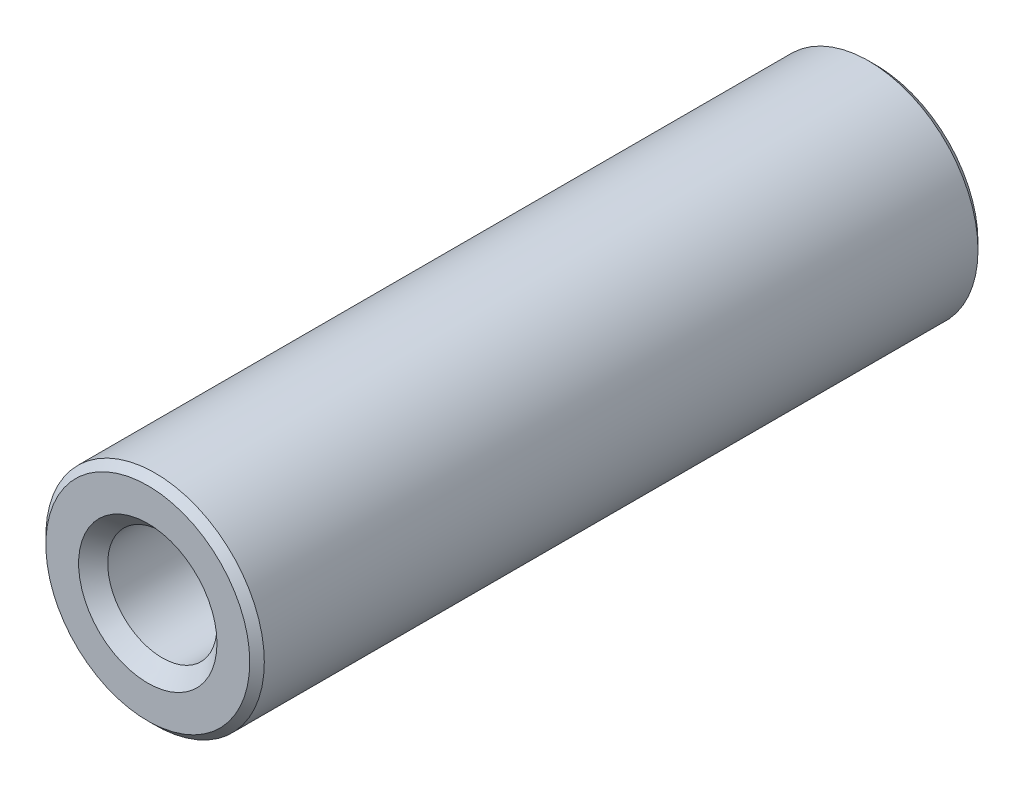
from build123d import *


with BuildPart() as part:
    # 草图1 → 旋转1 (revolve)
    with BuildSketch(Plane(origin=(0, 0, 0), x_dir=(1, 0, 0), z_dir=(0, 1, 0))):
        Polygon((1.5, -9.399940727), (0, -9.399940727), (0, -20.600059273), (1.5, -20.600059273), (1.5, -24.600059273), (1.899924924, -25), (2.79992954, -25), (3, -24.799924505), (3, -5.200041756), (2.799961089, -5), (1.899924924, -5), (1.5, -5.399940727), align=None)
    revolve(axis=Axis((0, 0, -25.003051641), (0, 0, 1)))


solid = part.part
